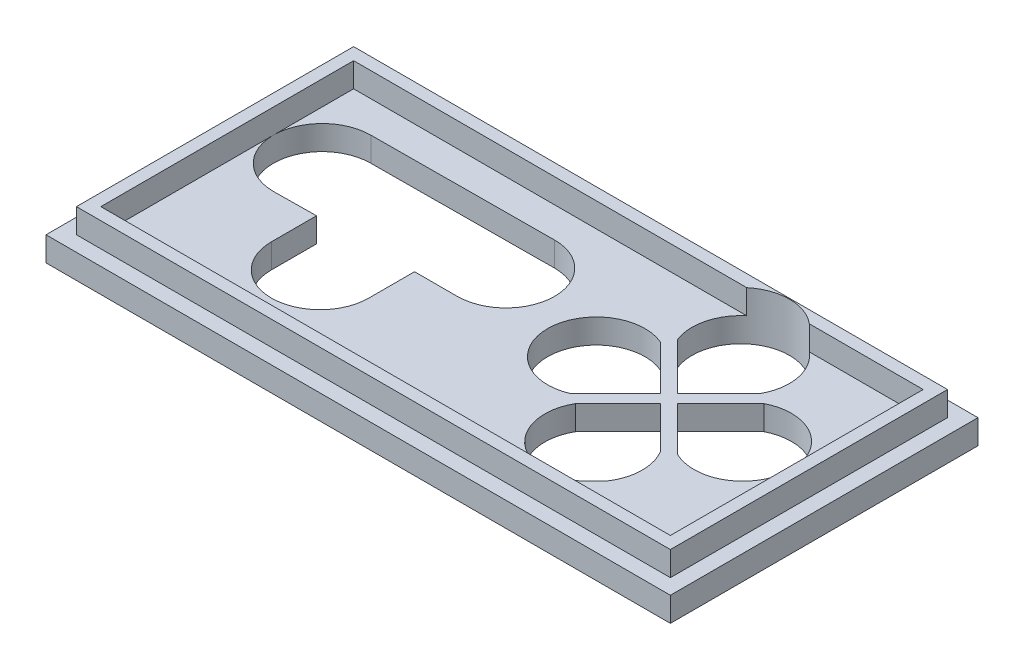
from build123d import *

# Parameters (mm, degrees)
SKETCH1_W           = 97.5
SKETCH1_H           = 45.5
SKETCH1_W_2         = 93.5
SKETCH1_H_2         = 41.5
BOSS_EXTRUDE1_DEPTH = 4
SKETCH2_W           = 102.5
SKETCH2_H           = 50.5
BOSS_EXTRUDE2_DEPTH = 4
CUT_EXTRUDE1_DEPTH  = 58.689903796


with BuildPart() as part:
    # Sketch1 → Boss-Extrude1 (new body)
    with BuildSketch(Plane(origin=(0, 0, 0), x_dir=(1, 0, 0), z_dir=(0, 1, 0))):
        Rectangle(SKETCH1_W, SKETCH1_H)
        Rectangle(SKETCH1_W_2, SKETCH1_H_2, mode=Mode.SUBTRACT)
    extrude(amount=BOSS_EXTRUDE1_DEPTH)

    # Sketch2 → Boss-Extrude2 (add)
    with BuildSketch(Plane(origin=(0, 0, 0), x_dir=(-1, 0, 0), z_dir=(0, -1, 0))):
        Rectangle(SKETCH2_W, SKETCH2_H)
    extrude(amount=BOSS_EXTRUDE2_DEPTH)

    # Sketch3 → Cut-Extrude1 (cut, through all)
    with BuildSketch(Plane.XZ.offset(4)):
        with BuildLine():
            Line((21.754778505, -2.585841929), (14.396321324, 4.772615252))
            ThreePointArc((14.396321324, 4.772615252), (3.257355265, -2.585841929), (14.396321324, -9.94429911))
            Line((14.396321324, -9.94429911), (21.754778505, -2.585841929))
        make_face()
        with BuildLine():
            ThreePointArc((27.699814048, 16.344452811), (17.739587878, 15.654593104), (16.208809841, 5.78855386))
            Line((16.208809841, 5.78855386), (23.168992067, -1.171628366))
            Line((23.168992067, -1.171628366), (30.046481727, 5.705861294))
            ThreePointArc((30.046481727, 5.705861294), (31.14634131, 10.054344559), (29.732993239, 14.31127362))
            Line((29.732993239, 14.31127362), (27.699814048, 16.344452811))
        make_face()
        with BuildLine():
            ThreePointArc((15.482875978, -11.68617158), (23.435669898, -22.607420615), (29.929242502, -10.760305926))
            Line((29.929242502, -10.760305926), (23.168992067, -4.000055491))
            Line((23.168992067, -4.000055491), (15.482875978, -11.68617158))
        make_face()
        with BuildLine():
            ThreePointArc((40.538950668, 3.505316191), (36.33465085, 5.37848968), (31.79403897, 4.624991411))
            Line((31.79403897, 4.624991411), (24.58320563, -2.585841929))
            Line((24.58320563, -2.585841929), (31.677379035, -9.680015334))
            ThreePointArc((31.677379035, -9.680015334), (41.608009289, -7.500810005), (41.380693911, 2.663572949))
            Line((41.380693911, 2.663572949), (40.538950668, 3.505316191))
        make_face()
        with BuildLine():
            Line((-31.75, 0.342207976), (-38.75, 0.422889955))
            ThreePointArc((-38.75, 0.422889955), (-46.75, -7.577110045), (-38.75, -15.577110045))
            Line((-38.75, -15.577110045), (-8.75, -15.75))
            ThreePointArc((-8.75, -15.75), (-0.75, -7.75), (-8.75, 0.25))
            Line((-8.75, 0.25), (-15.75, 0.25))
            Line((-15.75, 0.25), (-15.75, 7.75))
            ThreePointArc((-15.75, 7.75), (-23.75, 15.75), (-31.75, 7.75))
            Line((-31.75, 7.75), (-31.75, 0.342207976))
        make_face()
    extrude(amount=-CUT_EXTRUDE1_DEPTH, mode=Mode.SUBTRACT)


solid = part.part
